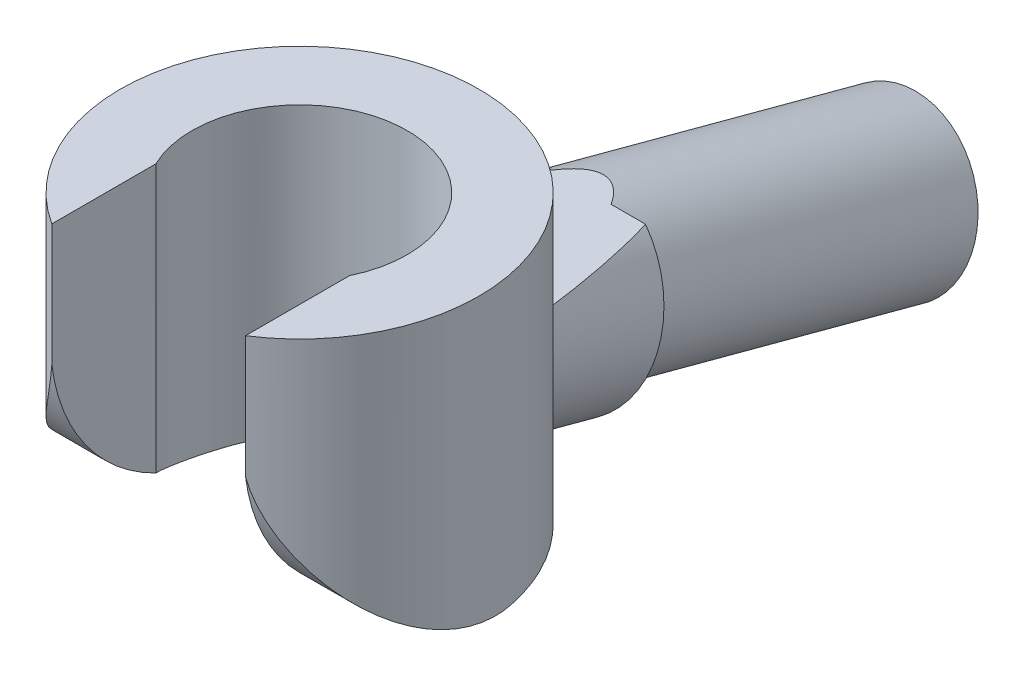
from build123d import *

# Parameters (mm, degrees)
SKETCH1_R                = 2.5
SKETCH1_R_2              = 1.5
BOSS_EXTRUDE1_DEPTH      = 4
SKETCH2_W                = 2.7
SKETCH2_H                = 3.154184917
CUT_EXTRUDE1_DEPTH       = 6.338539126
CUT_EXTRUDE2_DEPTH       = 9.860022573
BOSS_EXTRUDE2_REACH      = 13.474
BOSS_EXTRUDE2_END_RADIUS = 2.5
SKETCH5_R                = 1.125
BOSS_EXTRUDE3_REACH      = 18.274
BOSS_EXTRUDE3_END_RADIUS = 2.5
BOSS_EXTRUDE3_START      = -4.8
SKETCH6_R                = 1.375
CUT_EXTRUDE3_REACH       = 14.991
CUT_EXTRUDE3_END_RADIUS  = 2.5


with BuildPart() as part:
    # Sketch1 → Boss-Extrude1 (new body)
    with BuildSketch(Plane(origin=(0, 0, 0), x_dir=(1, 0, 0), z_dir=(0, 1, 0))):
        with Locations(Location((0, 0, 0), (0, 0, 270))):
            Circle(SKETCH1_R)
        with Locations(Location((0, 0, 0), (0, 0, 270))):
            Circle(SKETCH1_R_2, mode=Mode.SUBTRACT)
    extrude(amount=BOSS_EXTRUDE1_DEPTH)

    # Sketch2 → Cut-Extrude1 (cut, through all)
    with BuildSketch(Plane(origin=(0, 4, 0), x_dir=(1, 0, 0), z_dir=(0, 1, 0))):
        with Locations((0, -1.577092459)):
            Rectangle(SKETCH2_W, SKETCH2_H)
    extrude(amount=-CUT_EXTRUDE1_DEPTH, mode=Mode.SUBTRACT)

    # Sketch3 → Cut-Extrude2 (cut, through all)
    with BuildSketch(Plane(origin=(5, 0, 0), x_dir=(0, 0, -1), z_dir=(1, 0, 0))):
        with BuildLine():
            Line((-2.104162541, 2.3), (-2.104162541, 0))
            Line((-2.104162541, 0), (0.5, 0))
            ThreePointArc((0.5, 0), (-1.237214908, 0.657322297), (-2.104162541, 2.3))
        make_face()
    extrude(amount=-CUT_EXTRUDE2_DEPTH, mode=Mode.SUBTRACT)

    # Boss-Extrude2: up to this cylinder (the profile starts outside it)
    boss_extrude2_end = Plane(origin=(0, -0.152914, 0), z_dir=(0, -1, 0)) * Cylinder(BOSS_EXTRUDE2_END_RADIUS, 32.948, mode=Mode.PRIVATE)
    # Sketch5 → Boss-Extrude2 (add, up to the surface)
    with BuildSketch(Plane(origin=(0, -0.152914271, -8.295554958), x_dir=(-1, 0, 0), z_dir=(0, -0.2588190451025248, -0.9659258262890673)), mode=Mode.PRIVATE) as boss_extrude2_sk1:
        with Locations(Location((0, 0, 0), (0, 0, 90))):
            Circle(SKETCH5_R)
    boss_extrude2_tool1 = extrude(boss_extrude2_sk1.sketch, amount=-BOSS_EXTRUDE2_REACH, mode=Mode.PRIVATE) - boss_extrude2_end
    add(boss_extrude2_tool1.solids().sort_by_distance((0, -0.152914, -8.295555))[0])

    # Boss-Extrude3: up to this cylinder (the profile starts outside it)
    boss_extrude3_end = Plane(origin=(0, 1.089417, 0), z_dir=(0, -1, 0)) * Cylinder(BOSS_EXTRUDE3_END_RADIUS, 42.548, mode=Mode.PRIVATE)
    # Sketch6 → Boss-Extrude3 (add, up to the surface)
    with BuildSketch(Plane(origin=(0, -0.152914271, -8.295554958), x_dir=(-1, 0, 0), z_dir=(0, -0.2588190451025248, -0.9659258262890673)).offset(BOSS_EXTRUDE3_START), mode=Mode.PRIVATE) as boss_extrude3_sk1:
        with Locations(Location((0, 0, 0), (0, 0, 90))):
            Circle(SKETCH6_R)
    boss_extrude3_tool1 = extrude(boss_extrude3_sk1.sketch, amount=-BOSS_EXTRUDE3_REACH, mode=Mode.PRIVATE) - boss_extrude3_end
    add(boss_extrude3_tool1.solids().sort_by_distance((0, 1.089417, -3.659111))[0])

    # Cut-Extrude3: up to this cylinder (the profile starts outside it)
    cut_extrude3_end = Plane(origin=(0, 3.059919, 0), z_dir=(0, -1, 0)) * Cylinder(CUT_EXTRUDE3_END_RADIUS, 35.982, mode=Mode.PRIVATE)
    # Sketch7 → Cut-Extrude3 (cut, up to the surface)
    with BuildSketch(Plane.XY.offset(-10), mode=Mode.PRIVATE) as cut_extrude3_sk1:
        Polygon((0, 4.019838564), (-2.13014509, 4.019838564), (-2.13014509, 2.1), (2.0800272, 2.1), (2.0800272, 4.019838564), align=None)
    cut_extrude3_tool1 = extrude(cut_extrude3_sk1.sketch, amount=CUT_EXTRUDE3_REACH, mode=Mode.PRIVATE) - cut_extrude3_end
    add(cut_extrude3_tool1.solids().sort_by_distance((-0.025059, 3.059919, -10))[0], mode=Mode.SUBTRACT)


solid = part.part
